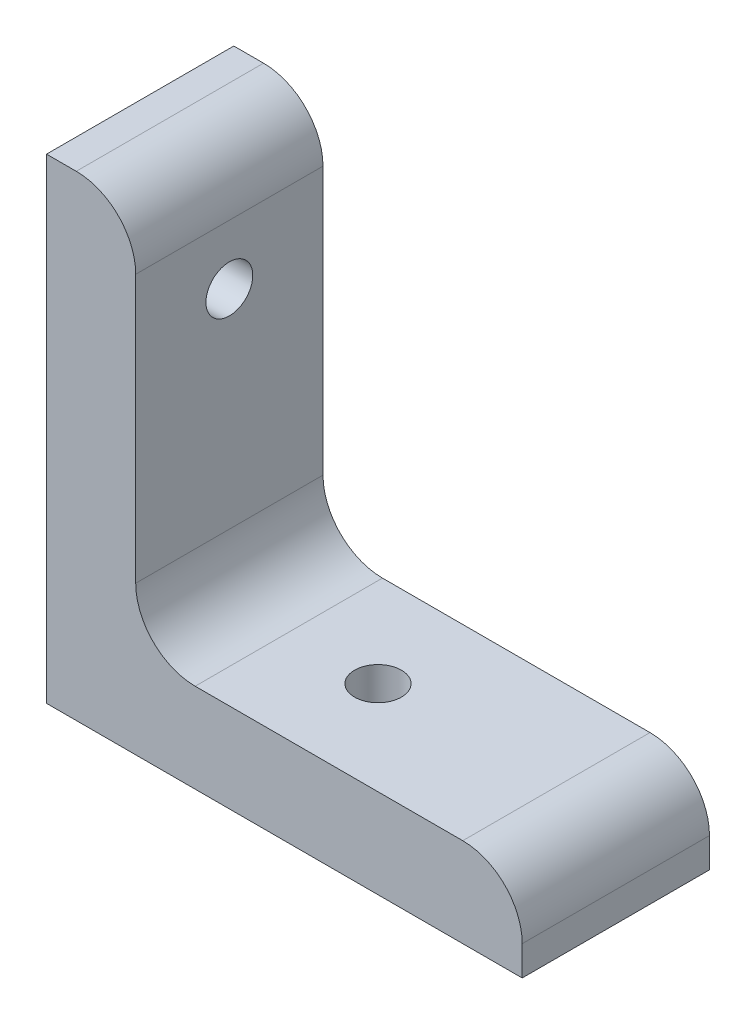
from build123d import *

# Parameters (mm, degrees)
BOSS_EXTRUDE1_DEPTH   = 20
FILLET1_R             = 6.35
F_5_0MM_DOWEL_HOLE1_D = 5
F_5_0MM_DOWEL_HOLE2_D = 5


with BuildPart() as part:
    # Sketch1 → Boss-Extrude1 (new body)
    with BuildSketch(Plane.XY):
        Polygon((0, 0), (0, 50.8), (9.525, 50.8), (9.525, 9.525), (50.8, 9.525), (50.8, 0), align=None)
    extrude(amount=-BOSS_EXTRUDE1_DEPTH)

    # Fillet1
    fillet1_edges = [part.edges().sort_by_distance(p)[0] for p in [
        (9.525, 50.8, -10),
        (9.525, 9.525, -10),
        (50.8, 9.525, -10),
    ]]
    fillet(fillet1_edges, radius=FILLET1_R)

    # Ø5.0mm Dowel Hole1 (through all)
    with Locations(Plane(origin=(0, 0, 0), x_dir=(-1, 0, 0), z_dir=(0, -1, 0))):
        with Locations((-25.4, 10)):
            Hole(F_5_0MM_DOWEL_HOLE1_D / 2)

    # Ø5.0mm Dowel Hole2 (through all)
    with Locations(Plane.ZY):
        with Locations((-10, 38.1)):
            Hole(F_5_0MM_DOWEL_HOLE2_D / 2)


solid = part.part
